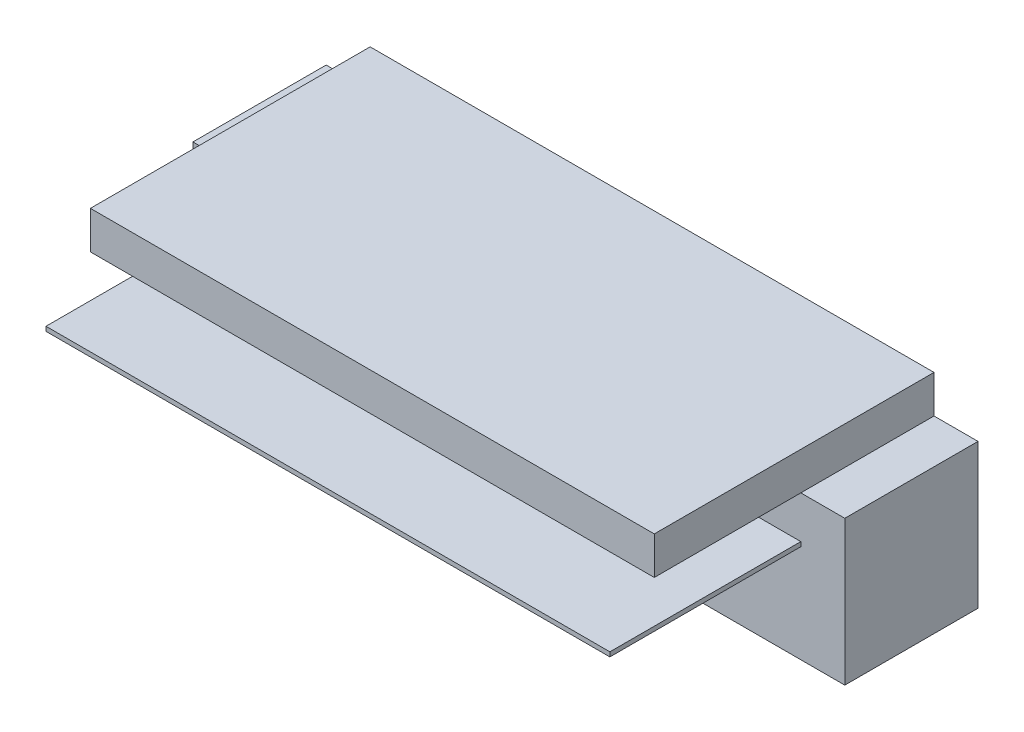
from build123d import *

# Parameters (mm, degrees)
SKETCH1_W           = 29.3624
SKETCH1_H           = 12.6
BOSS_EXTRUDE1_DEPTH = 8.21
SKETCH4_W           = 29.3624
SKETCH4_H           = 6.51
CUT_EXTRUDE2_DEPTH  = 6.6
BOSS_EXTRUDE2_START = -12.6
SKETCH2_W           = 25.4
SKETCH2_H           = 0.2
BOSS_EXTRUDE2_DEPTH = 14.6
SKETCH3_W           = 1.9812
SKETCH3_H           = 12.6
CUT_EXTRUDE1_DEPTH  = 1.7


with BuildPart() as part:
    # Sketch1 → Boss-Extrude1 (new body)
    with BuildSketch(Plane(origin=(0, 0, 0), x_dir=(1, 0, 0), z_dir=(0, 1, 0))):
        Rectangle(SKETCH1_W, SKETCH1_H)
    extrude(amount=BOSS_EXTRUDE1_DEPTH)

    # Sketch4 → Cut-Extrude2 (cut)
    with BuildSketch(Plane.XY.offset(6.3)):
        with Locations((0, 3.255)):
            Rectangle(SKETCH4_W, SKETCH4_H)
    extrude(amount=-CUT_EXTRUDE2_DEPTH, mode=Mode.SUBTRACT)

    # Sketch2 → Boss-Extrude2 (add)
    with BuildSketch(Plane.XY.offset(6.3).offset(BOSS_EXTRUDE2_START)):
        with Locations((0, 4.51)):
            Rectangle(SKETCH2_W, SKETCH2_H)
    extrude(amount=BOSS_EXTRUDE2_DEPTH)

    # Sketch3 → Cut-Extrude1 (cut)
    with BuildSketch(Plane(origin=(0, 8.21, 0), x_dir=(1, 0, 0), z_dir=(0, 1, 0))):
        with Locations((-13.6906, 0)):
            Rectangle(SKETCH3_W, SKETCH3_H)
        with Locations((13.6906, 0)):
            Rectangle(SKETCH3_W, SKETCH3_H)
    extrude(amount=-CUT_EXTRUDE1_DEPTH, mode=Mode.SUBTRACT)


solid = part.part
